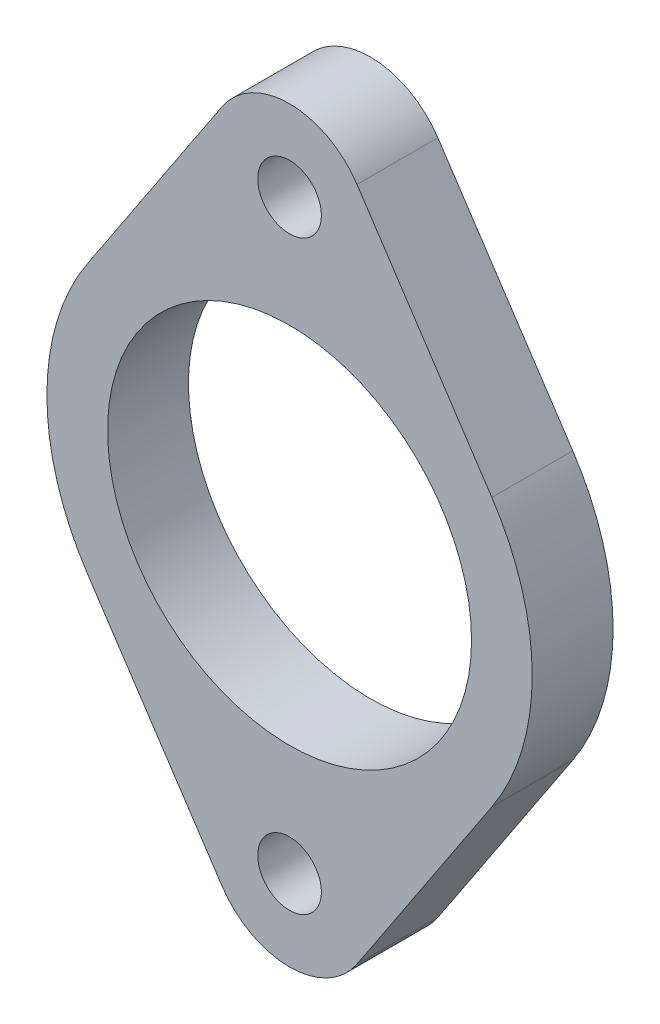
from build123d import *

# Parameters (mm, degrees)
SKETCH1_R             = 14.2875
BOSS_EXTRUDE1_DEPTH   = 3.175
F_5_0MM_DOWEL_HOLE1_D = 5


with BuildPart() as part:
    # Sketch1 → Boss-Extrude1 (new, symmetric)
    with BuildSketch(Plane.XY):
        with BuildLine():
            Line((-5.294178862, 26.506304348), (-15.882536585, 10.518913043))
            ThreePointArc((-15.882536585, 10.518913043), (-19.05, 0), (-15.882536585, -10.518913043))
            Line((-15.882536585, -10.518913043), (-5.294178862, -26.506304348))
            ThreePointArc((-5.294178862, -26.506304348), (0, -29.35), (5.294178862, -26.506304348))
            Line((5.294178862, -26.506304348), (15.882536585, -10.518913043))
            ThreePointArc((15.882536585, -10.518913043), (19.05, 0), (15.882536585, 10.518913043))
            Line((15.882536585, 10.518913043), (5.294178862, 26.506304348))
            ThreePointArc((5.294178862, 26.506304348), (0, 29.35), (-5.294178862, 26.506304348))
        make_face()
        Circle(SKETCH1_R, mode=Mode.SUBTRACT)
    extrude(amount=BOSS_EXTRUDE1_DEPTH, both=True)

    # Ø5.0mm Dowel Hole1 (through all)
    with Locations(Plane.XY.offset(3.175)):
        with Locations((0, 23), (0, -23)):
            Hole(F_5_0MM_DOWEL_HOLE1_D / 2)


solid = part.part
